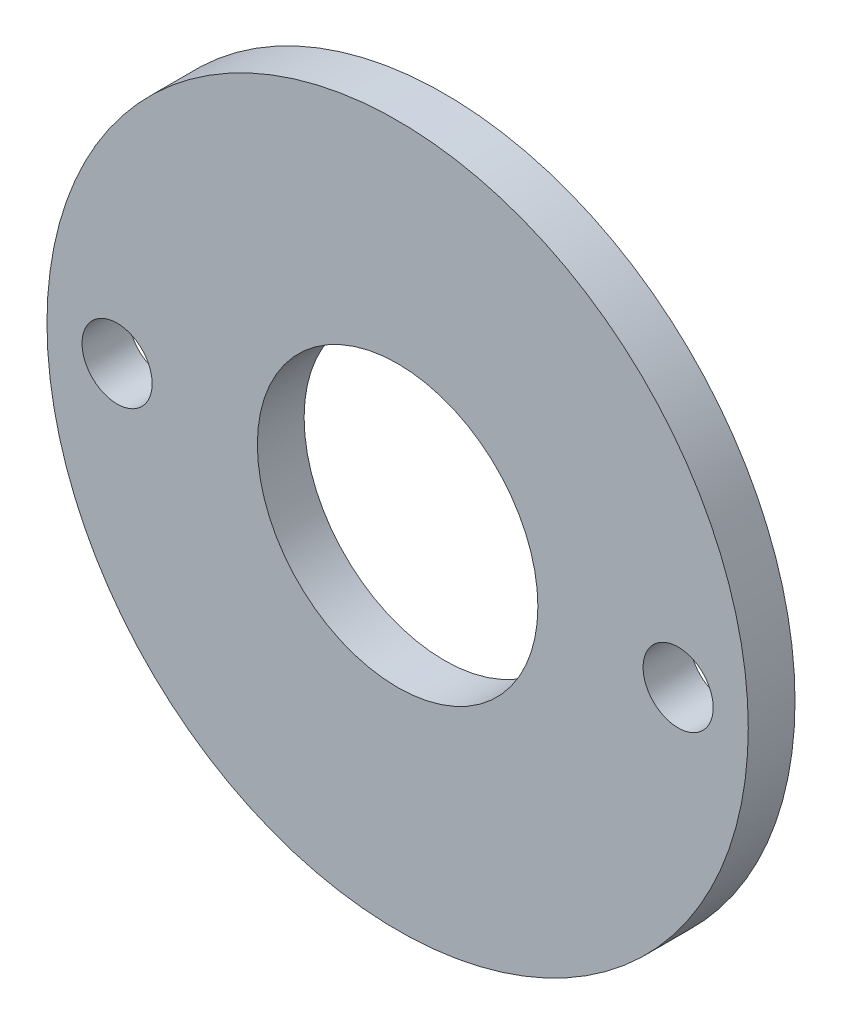
from build123d import *

# Parameters (mm, degrees)
SKETCH1_R           = 15
SKETCH1_R_2         = 6
SKETCH1_R_3         = 1.5
BOSS_EXTRUDE1_DEPTH = 2


with BuildPart() as part:
    # Sketch1 → Boss-Extrude1 (new body)
    with BuildSketch(Plane.XY):
        Circle(SKETCH1_R)
        Circle(SKETCH1_R_2, mode=Mode.SUBTRACT)
        with Locations((12, 0)):
            Circle(SKETCH1_R_3, mode=Mode.SUBTRACT)
        with Locations((-12, 0)):
            Circle(SKETCH1_R_3, mode=Mode.SUBTRACT)
    extrude(amount=BOSS_EXTRUDE1_DEPTH)


solid = part.part
